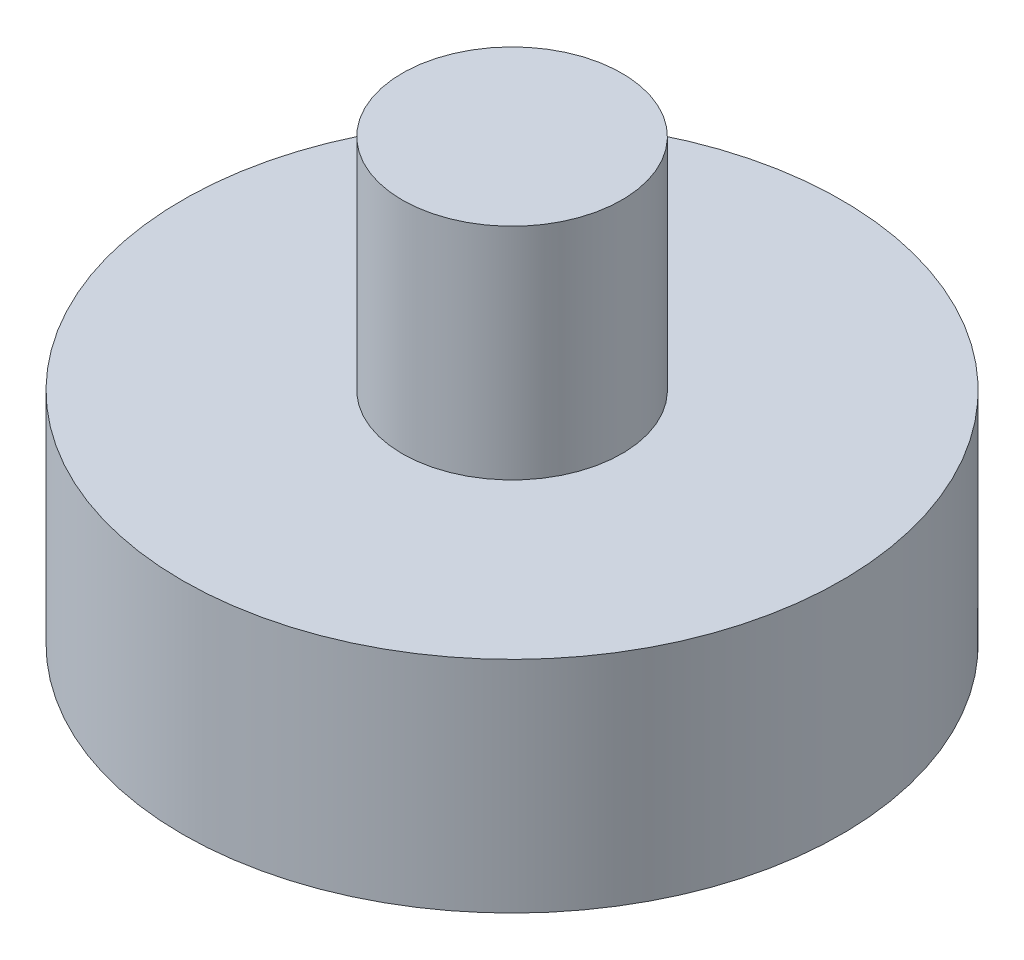
from build123d import *

# Parameters (mm, degrees)
CROQUIS1_R              = 7.5
SALIENTE_EXTRUIR1_DEPTH = 5
CROQUIS2_R              = 15
SALIENTE_EXTRUIR2_DEPTH = 10
CROQUIS3_R              = 5
SALIENTE_EXTRUIR3_DEPTH = 10


with BuildPart() as part:
    # Croquis1 → Saliente-Extruir1 (new body)
    with BuildSketch(Plane(origin=(0, 0, 0), x_dir=(1, 0, 0), z_dir=(0, 1, 0))):
        with Locations(Location((0, 0, 0), (0, 0, 270))):
            Circle(CROQUIS1_R)
    extrude(amount=SALIENTE_EXTRUIR1_DEPTH)

    # Croquis2 → Saliente-Extruir2 (add)
    with BuildSketch(Plane(origin=(0, 5, 0), x_dir=(1, 0, 0), z_dir=(0, 1, 0))):
        with Locations(Location((0, 0, 0), (0, 0, 270))):
            Circle(CROQUIS2_R)
    extrude(amount=SALIENTE_EXTRUIR2_DEPTH)

    # Croquis3 → Saliente-Extruir3 (add)
    with BuildSketch(Plane(origin=(0, 15, 0), x_dir=(1, 0, 0), z_dir=(0, 1, 0))):
        with Locations(Location((0, 0, 0), (0, 0, 270))):
            Circle(CROQUIS3_R)
    extrude(amount=SALIENTE_EXTRUIR3_DEPTH)


solid = part.part
